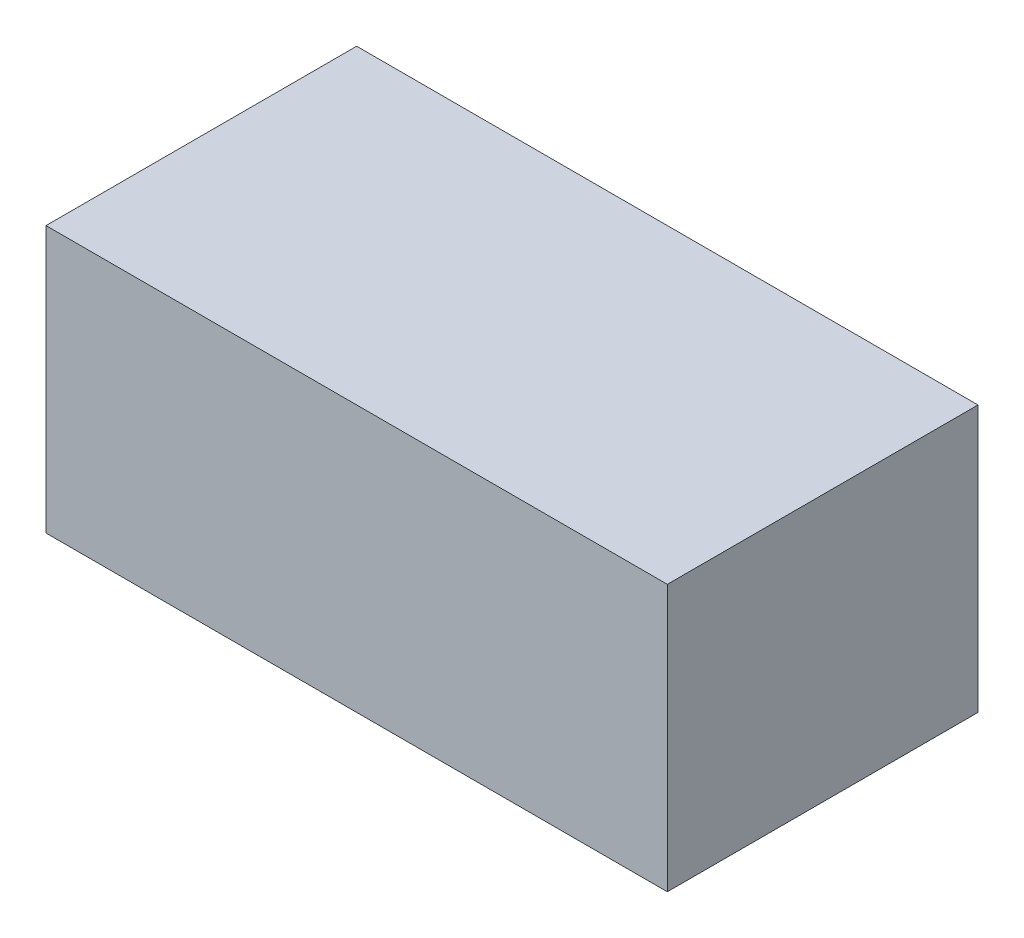
from build123d import *

# Parameters (mm, degrees)
SKETCH_1_W      = 70
SKETCH_1_H      = 35
EXTRUDE_1_DEPTH = 30


with BuildPart() as part:
    # 草图1 → 凸台-拉伸1 (new body)
    with BuildSketch(Plane(origin=(0, 0, 0), x_dir=(1, 0, 0), z_dir=(0, 1, 0))):
        Rectangle(SKETCH_1_W, SKETCH_1_H)
    extrude(amount=EXTRUDE_1_DEPTH)


solid = part.part
